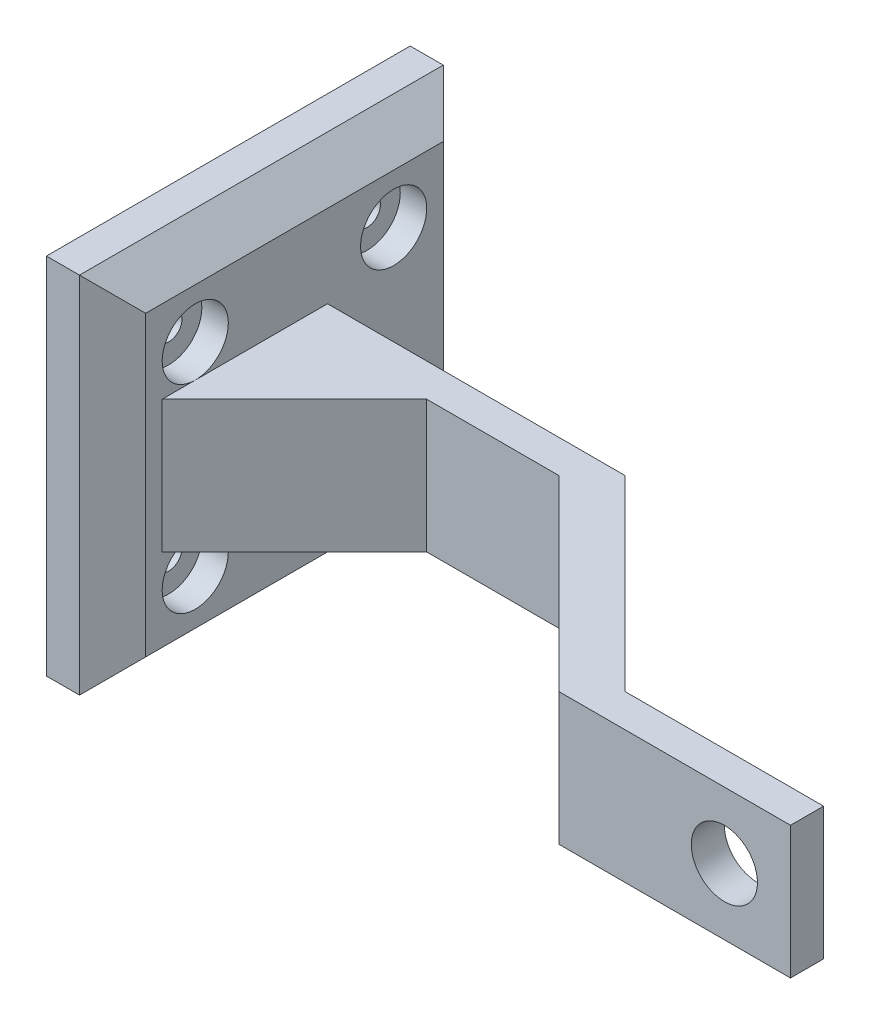
from build123d import *

# Parameters (mm, degrees)
SKETCH1_W           = 20
SKETCH1_H           = 20
SKETCH1_R           = 5
BOSS_EXTRUDE1_DEPTH = 5
SKETCH2_W           = 5
SKETCH2_H           = 20
BOSS_EXTRUDE2_DEPTH = 15
BOSS_EXTRUDE3_DEPTH = 20
SKETCH4_W           = 55
SKETCH4_H           = 55
BOSS_EXTRUDE4_DEPTH = 10
CHAMFER1_SIZE       = 20
CHAMFER2_SIZE       = 5
SKETCH5_R           = 2
CUT_EXTRUDE1_DEPTH  = 119.333988749
SKETCH6_R           = 5
SKETCH6_R_2         = 2
CUT_EXTRUDE2_DEPTH  = 4


with BuildPart() as part:
    # Sketch1 → Boss-Extrude1 (new body)
    with BuildSketch(Plane.XY):
        Rectangle(SKETCH1_W, SKETCH1_H)
        Circle(SKETCH1_R, mode=Mode.SUBTRACT)
    extrude(amount=BOSS_EXTRUDE1_DEPTH)

    # Sketch2 → Boss-Extrude2 (add)
    with BuildSketch(Plane.ZY.offset(10)):
        with Locations((2.5, 0)):
            Rectangle(SKETCH2_W, SKETCH2_H)
    extrude(amount=BOSS_EXTRUDE2_DEPTH)

    # Sketch3 → Boss-Extrude3 (add)
    with BuildSketch(Plane.XZ.offset(10)):
        Polygon((-25, 0), (-25, 5), (-53.284271247, -23.284271247), (-48.284271247, -23.284271247), (-48.284271247, -28.284271247), (-20, 0), align=None)
        Polygon((-48.284271247, -28.284271247), (-53.284271247, -23.284271247), (-93.284271247, -23.284271247), (-93.284271247, -28.284271247), align=None)
        Polygon((-48.284271247, -23.284271247), (-53.284271247, -23.284271247), (-48.284271247, -28.284271247), align=None)
    extrude(amount=-BOSS_EXTRUDE3_DEPTH)

    # Sketch4 → Boss-Extrude4 (add)
    with BuildSketch(Plane.ZY.offset(93.284271247)):
        with Locations((-23.284271247, 0)):
            Rectangle(SKETCH4_W, SKETCH4_H)
    extrude(amount=BOSS_EXTRUDE4_DEPTH)

    # Chamfer1
    chamfer1_edges = [part.edges().sort_by_distance(p)[0] for p in [
        (-93.284271247, 0, -23.284271247),
    ]]
    chamfer(chamfer1_edges, length=CHAMFER1_SIZE)

    # Chamfer2
    chamfer2_edges = [part.edges().sort_by_distance(p)[0] for p in [
        (-93.284271247, 0, -50.784271247),
        (-93.284271247, -27.5, -23.284271247),
        (-93.284271247, 0, 4.215728753),
        (-93.284271247, 27.5, -23.284271247),
    ]]
    chamfer(chamfer2_edges, length=CHAMFER2_SIZE)

    # Sketch5 → Cut-Extrude1 (cut, through all)
    with BuildSketch(Plane(origin=(-93.284271247, 0, 0), x_dir=(0, 0, -1), z_dir=(1, 0, 0))):
        with Locations((38.284271247, 15)):
            Circle(SKETCH5_R)
        with Locations(Location((38.284271247, -15, 0), (0, 0, 180))):
            Circle(SKETCH5_R)
        with Locations((8.284271247, -15)):
            Circle(SKETCH5_R)
        with Locations(Location((8.284271247, 15, 0), (0, 0, 180))):
            Circle(SKETCH5_R)
    extrude(amount=-CUT_EXTRUDE1_DEPTH, mode=Mode.SUBTRACT)

    # Sketch6 → Cut-Extrude2 (cut)
    # profile 1 of 4: a face of its own
    with BuildSketch(Plane(origin=(-93.284271247, 0, 0), x_dir=(0, 0, -1), z_dir=(1, 0, 0))):
        with Locations((8.284271247, 15)):
            Circle(SKETCH6_R)
        with Locations((8.284271247, 15)):
            Circle(SKETCH6_R_2, mode=Mode.SUBTRACT)
    # profile 2 of 4: a face of its own
    with BuildSketch(Plane(origin=(-93.284271247, 0, 0), x_dir=(0, 0, -1), z_dir=(1, 0, 0))):
        with Locations((8.284271247, -15)):
            Circle(SKETCH6_R)
        with Locations((8.284271247, -15)):
            Circle(SKETCH6_R_2, mode=Mode.SUBTRACT)
    # profile 3 of 4: a face of its own
    with BuildSketch(Plane(origin=(-93.284271247, 0, 0), x_dir=(0, 0, -1), z_dir=(1, 0, 0))):
        with Locations((38.284271247, -15)):
            Circle(SKETCH6_R)
        with Locations((38.284271247, -15)):
            Circle(SKETCH6_R_2, mode=Mode.SUBTRACT)
    # profile 4 of 4: a face of its own
    with BuildSketch(Plane(origin=(-93.284271247, 0, 0), x_dir=(0, 0, -1), z_dir=(1, 0, 0))):
        with Locations((38.284271247, 15)):
            Circle(SKETCH6_R)
        with Locations((38.284271247, 15)):
            Circle(SKETCH6_R_2, mode=Mode.SUBTRACT)
    extrude(amount=-CUT_EXTRUDE2_DEPTH, mode=Mode.SUBTRACT)


solid = part.part
